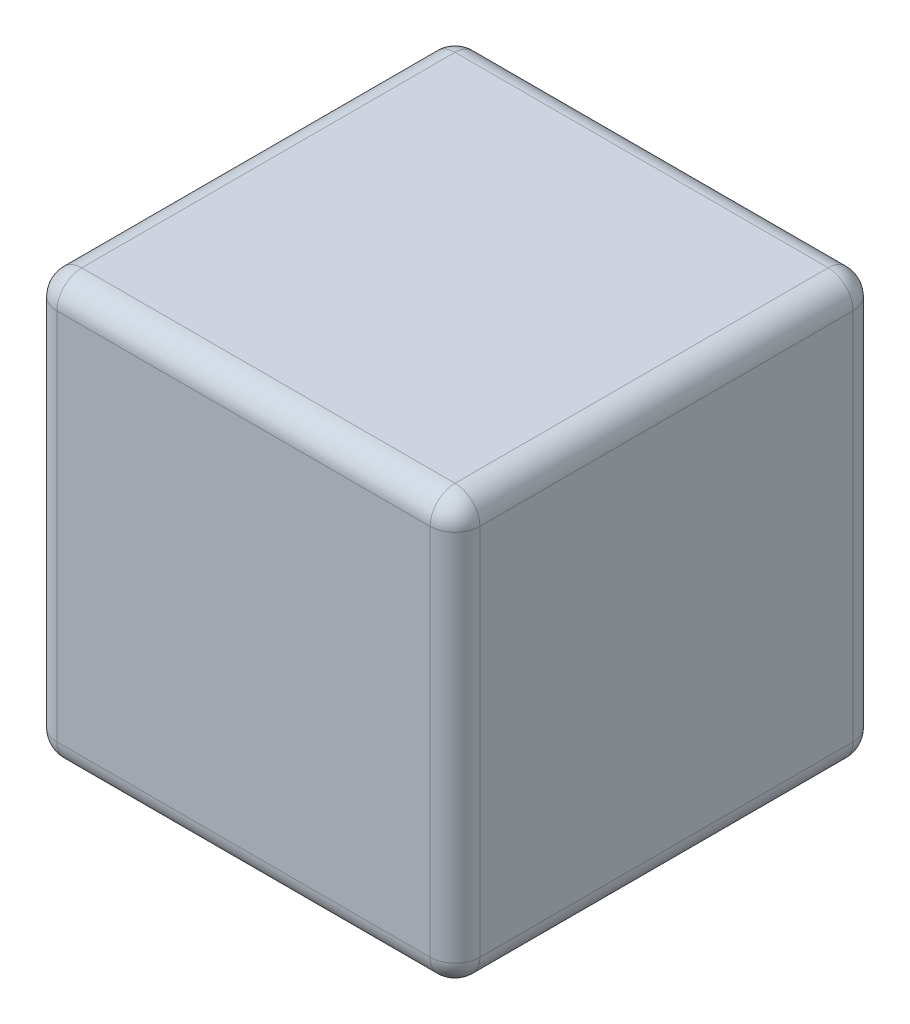
from build123d import *

# Parameters (mm, degrees)
SKETCH_1_W      = 17
SKETCH_1_H      = 17
EXTRUDE_1_DEPTH = 17
FILLET_1_R      = 1


with BuildPart() as part:
    # 草图1 → 凸台-拉伸1 (new body)
    with BuildSketch(Plane(origin=(0, 0, 0), x_dir=(1, 0, 0), z_dir=(0, 1, 0))):
        with Locations((8.5, 8.5)):
            Rectangle(SKETCH_1_W, SKETCH_1_H)
    extrude(amount=EXTRUDE_1_DEPTH)

    # 圆角1
    fillet_1_edges = [part.edges().sort_by_distance(p)[0] for p in [
        (17, 17, -8.5),
        (8.5, 17, -17),
        (0, 17, -8.5),
        (8.5, 0, -17),
        (17, 0, -8.5),
        (8.5, 0, 0),
        (0, 0, -8.5),
        (0, 8.5, -17),
        (17, 8.5, -17),
        (17, 8.5, 0),
        (0, 8.5, 0),
        (8.5, 17, 0),
    ]]
    fillet(fillet_1_edges, radius=FILLET_1_R)


solid = part.part
